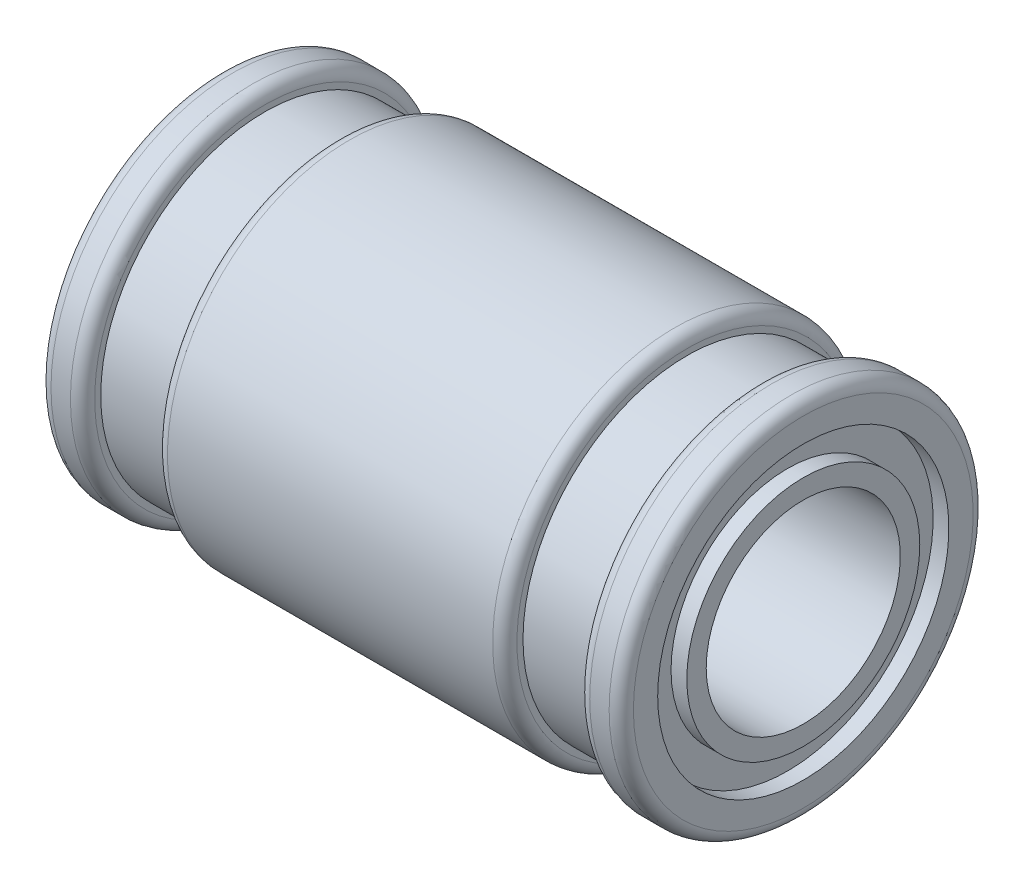
from build123d import *

# Parameters (mm, degrees)
FILLET4_R = 0.5
FILLET5_R = 0.5


with BuildPart() as part:
    # Sketch1 → Revolve1 (revolve)
    with BuildSketch(Plane.XY, mode=Mode.PRIVATE) as revolve1_sk:
        Polygon((0, 4.8), (0, 4), (24, 4), (24, 4.8), (23.35, 4.8), (23.35, 6), (24, 6), (24, 7.5), (22.2, 7.5), (22.2, 6.75), (19.2, 6.75), (19.2, 7.5), (4.8, 7.5), (4.8, 6.75), (1.8, 6.75), (1.8, 7.5), (0, 7.5), (0, 6), (0.65, 6), (0.65, 4.8), align=None)
    revolve(revolve1_sk.sketch.rotate(Axis((0, 0, 0), (1, 0, 0)), 90), axis=Axis((0, 0, 0), (1, 0, 0)))

    # Fillet4
    fillet4_edges = [part.edges().sort_by_distance(p)[0] for p in [
        (0, 0, -7.5),
    ]]
    fillet(fillet4_edges, radius=FILLET4_R)

    # Fillet5
    fillet5_edges = [part.edges().sort_by_distance(p)[0] for p in [
        (1.8, 0, -7.5),
        (4.8, 0, -7.5),
        (19.2, 0, -7.5),
        (22.2, 0, -7.5),
        (24, 0, -7.5),
    ]]
    fillet(fillet5_edges, radius=FILLET5_R)


solid = part.part
